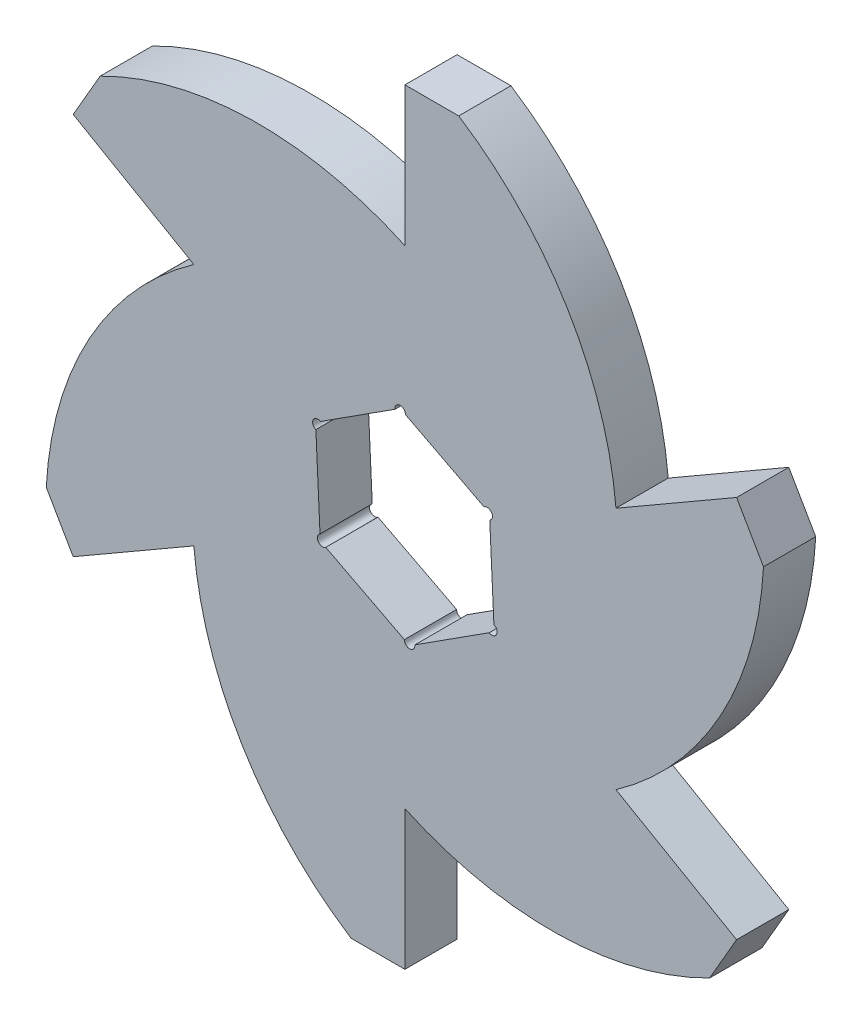
from build123d import *

# Parameters (mm, degrees)
BOSS_EXTRUDE1_DEPTH = 15


with BuildPart() as part:
    # Sketch1 → Boss-Extrude1 (new body)
    with BuildSketch(Plane.XY):
        with BuildLine():
            Line((0, 70), (0, 110))
            Line((0, 110), (15.459491817, 110))
            ThreePointArc((15.459491817, 110), (46.684314733, 77.704911176), (60.621778265, 35))
            Line((60.621778265, 35), (95.262794416, 55))
            Line((95.262794416, 55), (102.992540325, 41.611687357))
            ThreePointArc((102.992540325, 41.611687357), (90.636584443, -1.577346929), (60.621778265, -35))
            Line((60.621778265, -35), (95.262794416, -55))
            Line((95.262794416, -55), (87.533048508, -68.388312643))
            ThreePointArc((87.533048508, -68.388312643), (43.952269711, -79.282258105), (0, -70))
            Line((0, -70), (0, -110))
            Line((0, -110), (-15.459491817, -110))
            ThreePointArc((-15.459491817, -110), (-46.684314733, -77.704911176), (-60.621778265, -35))
            Line((-60.621778265, -35), (-95.262794416, -55))
            Line((-95.262794416, -55), (-102.992540325, -41.611687357))
            ThreePointArc((-102.992540325, -41.611687357), (-90.636584443, 1.577346929), (-60.621778265, 35))
            Line((-60.621778265, 35), (-95.262794416, 55))
            Line((-95.262794416, 55), (-87.533048508, 68.388312643))
            ThreePointArc((-87.533048508, 68.388312643), (-43.952269711, 79.282258105), (0, 70))
        make_face()
        with BuildLine():
            Line((-2.839422275, 27.882179507), (-24.228498402, 14.15748888))
            ThreePointArc((-24.228498402, 14.15748888), (-26.341250207, 13.541785954), (-25.566386903, 11.482077931))
            Line((-25.566386903, 11.482077931), (-24.374994225, -13.903750672))
            ThreePointArc((-24.374994225, -13.903750672), (-24.898155753, -16.041298869), (-22.726964628, -16.400101575))
            Line((-22.726964628, -16.400101575), (-0.146495823, -28.061239552))
            ThreePointArc((-0.146495823, -28.061239552), (1.443094454, -29.583084824), (2.839422275, -27.882179507))
            Line((2.839422275, -27.882179507), (24.228498402, -14.15748888))
            ThreePointArc((24.228498402, -14.15748888), (26.341250207, -13.541785954), (25.566386903, -11.482077931))
            Line((25.566386903, -11.482077931), (24.374994225, 13.903750672))
            ThreePointArc((24.374994225, 13.903750672), (24.898155753, 16.041298869), (22.726964628, 16.400101575))
            Line((22.726964628, 16.400101575), (0.146495823, 28.061239552))
            ThreePointArc((0.146495823, 28.061239552), (-1.443094454, 29.583084824), (-2.839422275, 27.882179507))
        make_face(mode=Mode.SUBTRACT)
    extrude(amount=BOSS_EXTRUDE1_DEPTH)


solid = part.part
